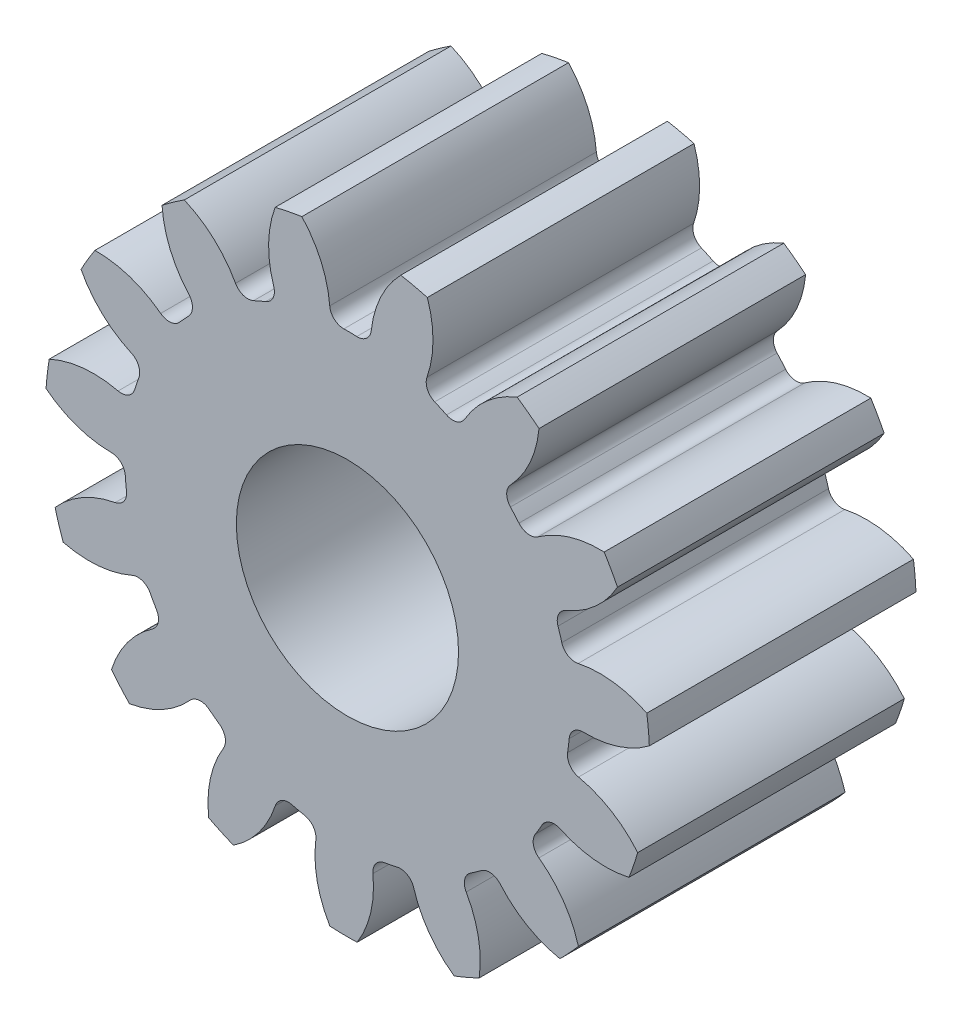
from build123d import *

# Parameters (mm, degrees)
SKETCH3_R         = 10.795
GEARBODY_DEPTH    = 9.525
TOOTHCUT_DEPTH    = 18.99415669
CIRPATTERN1_COUNT = 15
BOREDIA_R         = 3.96875
BORE_DEPTH        = 12700


with BuildPart() as part:
    # Sketch3 → gearBody (new body)
    with BuildSketch(Plane.XY):
        with Locations(Location((0, 0, 0), (0, 0, 180))):
            Circle(SKETCH3_R)
    extrude(amount=GEARBODY_DEPTH)

    # Sketch2 → toothCut (cut, through all)
    with BuildSketch(Plane.XY):
        with BuildLine():
            ThreePointArc((7.864672513, -1.163016041), (7.895149368, -0.933968145), (7.918956949, -0.704131297))
            ThreePointArc((7.918956949, -0.704131297), (8.083653363, -0.376064465), (8.4281848, -0.249372536))
            ThreePointArc((8.4281848, -0.249372536), (10.244786828, 0.166211992), (11.641974978, 1.399345683))
            ThreePointArc((11.641974978, 1.399345683), (11.644578548, -1.377512307), (10.99412895, -4.077116426))
            ThreePointArc((10.99412895, -4.077116426), (9.923230012, -2.552016793), (8.253736923, -1.724039588))
            ThreePointArc((8.253736923, -1.724039588), (7.948275924, -1.520455861), (7.864672513, -1.163016041))
        make_face()
    toothcut = extrude(amount=TOOTHCUT_DEPTH, mode=Mode.SUBTRACT)

    # CirPattern1: toothCut ×15 about axis
    cirpattern1_axis = Axis((0, 0, 0), (0, 0, 1))
    for i in range(1, CIRPATTERN1_COUNT):
        add(toothcut.rotate(cirpattern1_axis, i * 360 / CIRPATTERN1_COUNT), mode=Mode.SUBTRACT)

    # boreDia → bore (cut, symmetric)
    with BuildSketch(Plane.XY):
        Circle(BOREDIA_R)
    extrude(amount=BORE_DEPTH, both=True, mode=Mode.SUBTRACT)


solid = part.part
